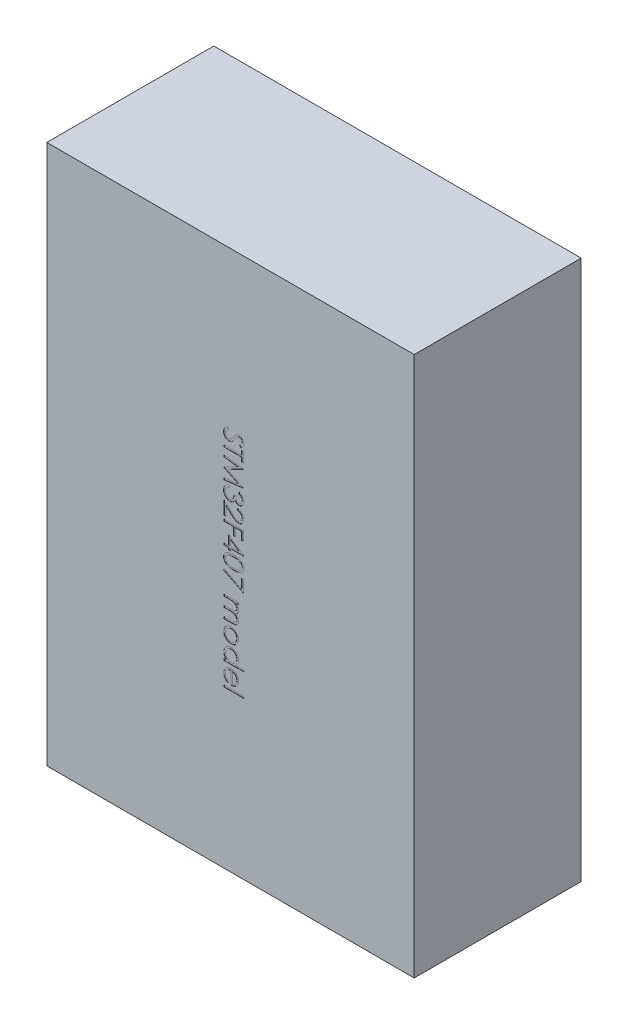
from build123d import *

# Parameters (mm, degrees)
SKETCH_1_W          = 66
SKETCH_1_H          = 97
EXTRUDE_1_DEPTH     = 30
SKETCH_2_W          = 3.58974359
SKETCH_2_H          = 0.314102564
CUT_EXTRUDE_1_DEPTH = 0.04


with BuildPart() as part:
    # 스케치1 → 보스-돌출1 (new body)
    with BuildSketch(Plane.XY):
        Rectangle(SKETCH_1_W, SKETCH_1_H)
    extrude(amount=EXTRUDE_1_DEPTH)

    # 스케치2 → 컷-돌출1 (cut)
    # profile 1 of 14: a face of its own
    with BuildSketch(Plane.XY.offset(30)):
        with BuildLine():
            Line((-0.48025151, 20.483974359), (-0.302867695, 20.188100962))
            add(Edge.make_bspline(
                [(-0.302867695, 20.188100962), (-0.34893208, 20.160582724), (-0.437189664, 20.107858844), (-0.556447705, 20.019907485), (-0.657809861, 19.928774573), (-0.740686469, 19.83378524), (-0.805935356, 19.735519292), (-0.852137587, 19.633335238), (-0.880953563, 19.527577427), (-0.884453649, 19.455603606), (-0.886201029, 19.419671474)],
                knots=[0, 0, 0, 0, 1.272034388, 2.437168799, 3.508375237, 4.49857839, 5.41946034, 6.295179144, 7.148887113, 8, 8, 8, 8], degree=3))
            add(Edge.make_bspline(
                [(-0.886201029, 19.419671474), (-0.885346357, 19.388984611), (-0.883651969, 19.328147831), (-0.867371151, 19.238585635), (-0.842359082, 19.151603657), (-0.806537929, 19.068995675), (-0.763200243, 18.991897693), (-0.710851254, 18.924299317), (-0.652255027, 18.865823682), (-0.586836081, 18.818121937), (-0.516723168, 18.781090763), (-0.444111807, 18.754293981), (-0.369321393, 18.73723944), (-0.318615749, 18.73506874), (-0.29305199, 18.733974359)],
                knots=[0, 0, 0, 0, 1.095270387, 2.171376115, 3.241375676, 4.322296363, 5.380636668, 6.392615365, 7.366724986, 8.328592944, 9.273498763, 10.190095884, 11.087518669, 12, 12, 12, 12], degree=3))
            add(Edge.make_bspline(
                [(-0.29305199, 18.733974359), (-0.263911141, 18.73544867), (-0.204672051, 18.738445728), (-0.117272398, 18.763777208), (-0.030779828, 18.803626455), (0.022721437, 18.840389099), (0.050497689, 18.85947516)],
                knots=[0, 0, 0, 0, 0.938893495, 1.908633276, 2.914225137, 4, 4, 4, 4], degree=3))
            add(Edge.make_bspline(
                [(0.050497689, 18.85947516), (0.070585493, 18.875101411), (0.112881115, 18.908003067), (0.174786586, 18.965349754), (0.240202428, 19.030891476), (0.308863004, 19.104955892), (0.3795144, 19.18901525), (0.453629353, 19.281343492), (0.530985117, 19.382418564), (0.582139729, 19.453651707), (0.608590638, 19.490484776)],
                knots=[0, 0, 0, 0, 0.72226686, 1.520759855, 2.393439377, 3.351307446, 4.386958158, 5.510256019, 6.712608938, 8, 8, 8, 8], degree=3))
            add(Edge.make_bspline(
                [(0.608590638, 19.490484776), (0.634825229, 19.52730386), (0.684983769, 19.597699145), (0.759330441, 19.696221229), (0.827737594, 19.784203539), (0.889252341, 19.862094389), (0.946557644, 19.927878643), (0.996582259, 19.98396119), (1.041997444, 20.028272933), (1.071435414, 20.052931372), (1.084652337, 20.064002404)],
                knots=[0, 0, 0, 0, 1.452255772, 2.776602448, 3.96446981, 5.032613149, 5.964194703, 6.766668629, 7.446264616, 8, 8, 8, 8], degree=3))
            add(Edge.make_bspline(
                [(1.084652337, 20.064002404), (1.105253374, 20.079474949), (1.145768077, 20.109903786), (1.209092935, 20.150069791), (1.2739162, 20.184208954), (1.340412065, 20.210971286), (1.407646994, 20.233507505), (1.47649824, 20.248665436), (1.546656858, 20.258156833), (1.593870359, 20.259128819), (1.617504901, 20.259615385)],
                knots=[0, 0, 0, 0, 1.068054152, 2.10047183, 3.106115577, 4.101338837, 5.06977816, 6.043150881, 7.020423561, 8, 8, 8, 8], degree=3))
            add(Edge.make_bspline(
                [(1.617504901, 20.259615385), (1.654537776, 20.258315869), (1.727811974, 20.255744614), (1.834797821, 20.233821493), (1.937252449, 20.199622872), (2.032919093, 20.150161654), (2.121574036, 20.089009275), (2.201862776, 20.016736768), (2.269933705, 19.930929074), (2.328718871, 19.83625649), (2.375132217, 19.733298793), (2.410329813, 19.62560481), (2.430007424, 19.512702299), (2.432862905, 19.436102663), (2.434311792, 19.397235577)],
                knots=[0, 0, 0, 0, 1.005541892, 1.989591032, 2.955705311, 3.932863626, 4.905387107, 5.876519979, 6.856563935, 7.871847665, 8.897921447, 9.918317993, 10.943742853, 12, 12, 12, 12], degree=3))
            add(Edge.make_bspline(
                [(2.434311792, 19.397235577), (2.432915888, 19.355985329), (2.430147645, 19.274181154), (2.405216629, 19.153625107), (2.364945144, 19.037331335), (2.318562162, 18.943720548), (2.272444271, 18.870583422), (2.230421451, 18.814811656), (2.182047232, 18.758293918), (2.127187723, 18.700575948), (2.06534105, 18.642635263), (1.996930338, 18.583611818), (1.922373789, 18.523367547), (1.869149287, 18.484611688), (1.841863875, 18.46474359)],
                knots=[0, 0, 0, 0, 1.286821612, 2.551921131, 3.825787379, 5.12137259, 5.803616487, 6.523126609, 7.299589446, 8.125436757, 9.008162487, 9.944516264, 10.946261234, 12, 12, 12, 12], degree=3))
            Line((1.841863875, 18.46474359), (1.626619484, 18.748697917))
            add(Edge.make_bspline(
                [(1.626619484, 18.748697917), (1.648708175, 18.765843849), (1.69124583, 18.798862906), (1.750817137, 18.848992395), (1.805233644, 18.896241034), (1.852498681, 18.942791463), (1.895201113, 18.986184999), (1.931759888, 19.028302354), (1.962538672, 19.06853569), (1.995368923, 19.119256839), (2.028119528, 19.183142401), (2.055242621, 19.263258153), (2.072128635, 19.346753238), (2.074256076, 19.403465428), (2.075337433, 19.432291667)],
                knots=[0, 0, 0, 0, 1.181667846, 2.275615987, 3.290305621, 4.226321945, 5.078535498, 5.862783384, 6.581873284, 7.217493746, 8.414623899, 9.604724551, 10.782505457, 12, 12, 12, 12], degree=3))
            add(Edge.make_bspline(
                [(2.075337433, 19.432291667), (2.074125733, 19.468448189), (2.071789084, 19.538172636), (2.046269098, 19.637162873), (2.006087238, 19.726256798), (1.94977226, 19.802809363), (1.883051267, 19.86654634), (1.806272412, 19.912651799), (1.72149001, 19.940401963), (1.662348353, 19.943788243), (1.632228458, 19.945512821)],
                knots=[0, 0, 0, 0, 1.14458467, 2.207223713, 3.21896685, 4.227309161, 5.202851033, 6.127160689, 7.046193047, 8, 8, 8, 8], degree=3))
            add(Edge.make_bspline(
                [(1.632228458, 19.945512821), (1.613481761, 19.945101392), (1.575957711, 19.944277863), (1.520373073, 19.93356699), (1.465281841, 19.918379293), (1.410439046, 19.896151164), (1.35455447, 19.866210872), (1.297778994, 19.825501076), (1.238679174, 19.774571444), (1.200279024, 19.735481868), (1.180004901, 19.71484375)],
                knots=[0, 0, 0, 0, 0.858526328, 1.718456515, 2.587092892, 3.476767204, 4.426280253, 5.487868114, 6.673670035, 8, 8, 8, 8], degree=3))
            add(Edge.make_bspline(
                [(1.180004901, 19.71484375), (1.173167875, 19.707182378), (1.156924667, 19.68898071), (1.130332386, 19.655704785), (1.097529614, 19.611761986), (1.056942297, 19.558299785), (1.009860835, 19.494332424), (0.956887223, 19.419852867), (0.896301764, 19.335691335), (0.853944223, 19.275969419), (0.831547369, 19.244391026)],
                knots=[0, 0, 0, 0, 0.420754252, 0.999615792, 1.744751191, 2.668019286, 3.750313428, 4.999500688, 6.413464383, 8, 8, 8, 8], degree=3))
            add(Edge.make_bspline(
                [(0.831547369, 19.244391026), (0.803906009, 19.206405112), (0.750382347, 19.132850656), (0.669966667, 19.028193076), (0.591318899, 18.933299268), (0.514941292, 18.847836064), (0.441413199, 18.770959156), (0.369850018, 18.703521435), (0.300764446, 18.644835755), (0.21219187, 18.581656536), (0.103410786, 18.517098717), (-0.029867453, 18.46165721), (-0.163663773, 18.426698862), (-0.25359061, 18.422127347), (-0.297959843, 18.419871795)],
                knots=[0, 0, 0, 0, 1.163667725, 2.253281268, 3.268753668, 4.215851969, 5.092017293, 5.902905408, 6.650798638, 7.335211899, 8.59617414, 9.77448103, 10.901945474, 12, 12, 12, 12], degree=3))
            add(Edge.make_bspline(
                [(-0.297959843, 18.419871795), (-0.329337961, 18.420529298), (-0.391484854, 18.421831536), (-0.482743528, 18.436787141), (-0.57136102, 18.458726549), (-0.656322235, 18.491689845), (-0.738764024, 18.532237814), (-0.817926984, 18.582320374), (-0.892722869, 18.642694869), (-0.964708176, 18.709798674), (-1.029731603, 18.784373305), (-1.087887777, 18.863005117), (-1.136564128, 18.946204596), (-1.175748717, 19.033569047), (-1.206881075, 19.124615188), (-1.229258364, 19.219438834), (-1.243023728, 19.318304042), (-1.244450161, 19.385505116), (-1.245175388, 19.419671474)],
                knots=[0, 0, 0, 0, 0.983610584, 1.948120116, 2.894308362, 3.843560551, 4.801159957, 5.773581695, 6.77566113, 7.813174769, 8.857584665, 9.875476876, 10.877851407, 11.875574773, 12.875048225, 13.892438445, 14.928473903, 16, 16, 16, 16], degree=3))
            add(Edge.make_bspline(
                [(-1.245175388, 19.419671474), (-1.244658349, 19.446105651), (-1.243630783, 19.498641092), (-1.234761651, 19.576138789), (-1.221754962, 19.652213394), (-1.201924472, 19.725909697), (-1.177298153, 19.798145352), (-1.147146788, 19.868276473), (-1.111253121, 19.936473445), (-1.0695577, 20.002815905), (-1.021505197, 20.067928988), (-0.965973529, 20.13147888), (-0.903346264, 20.194192596), (-0.832981147, 20.254920498), (-0.755629955, 20.314781958), (-0.670644561, 20.372663746), (-0.578466131, 20.429744504), (-0.513601198, 20.465560107), (-0.48025151, 20.483974359)],
                knots=[0, 0, 0, 0, 0.915384692, 1.819241058, 2.699029451, 3.586605375, 4.459625921, 5.340865773, 6.228072412, 7.126546901, 8.052715223, 9.028303326, 10.047266019, 11.120332924, 12.245748783, 13.433636234, 14.680528497, 16, 16, 16, 16], degree=3))
        make_face()
    # profile 2 of 14: a face of its own
    with BuildSketch(Plane.XY.offset(30)):
        Polygon((1.985593843, 18.105769231), (2.344568202, 18.105769231), (2.344568202, 16.266025641), (1.985593843, 16.266025641), (1.985593843, 17.028846154), (-1.155431798, 17.028846154), (-1.155431798, 17.342948718), (1.985593843, 17.342948718), align=None)
    # profile 3 of 14: a face of its own
    with BuildSketch(Plane.XY.offset(30)):
        Polygon((-1.155431798, 15.817307692), (2.344568202, 15.355268429), (2.344568202, 15.310396635), (-0.52722667, 13.865384615), (2.344568202, 12.423878205), (2.344568202, 12.378305288), (-1.155431798, 11.913461538), (-1.155431798, 12.228966346), (1.362997689, 12.564102564), (-1.155431798, 13.827524038), (-1.155431798, 13.89833734), (1.368606664, 15.166666667), (-1.155431798, 15.501101763), align=None)
    # profile 4 of 14: a face of its own
    with BuildSketch(Plane.XY.offset(30)):
        with BuildLine():
            Line((1.536875894, 11.060897436), (1.536875894, 11.375))
            add(Edge.make_bspline(
                [(1.536875894, 11.375), (1.572108378, 11.366490449), (1.640985003, 11.349854974), (1.739392264, 11.3151574), (1.832515785, 11.277358145), (1.918611859, 11.231969041), (1.999410761, 11.182460286), (2.073079886, 11.125737565), (2.141492851, 11.064417842), (2.202206089, 10.996592893), (2.257183818, 10.925464231), (2.304058875, 10.850029612), (2.344383028, 10.771806718), (2.37760326, 10.690253585), (2.402628784, 10.605127413), (2.420785589, 10.51719779), (2.432576704, 10.42623429), (2.433727467, 10.364486699), (2.434311792, 10.333133013)],
                knots=[0, 0, 0, 0, 1.162005537, 2.271625781, 3.343758855, 4.383309926, 5.390229558, 6.379919256, 7.361854164, 8.333198761, 9.295911338, 10.242430842, 11.177959212, 12.116337295, 13.062827104, 14.020064771, 14.994644689, 16, 16, 16, 16], degree=3))
            add(Edge.make_bspline(
                [(2.434311792, 10.333133013), (2.432932562, 10.287450271), (2.430204186, 10.19708126), (2.40528975, 10.064318213), (2.365864617, 9.936291394), (2.31139089, 9.814402146), (2.244203577, 9.701183713), (2.16423884, 9.600447527), (2.073039539, 9.513559016), (1.972306974, 9.440664638), (1.864651465, 9.383589639), (1.753851308, 9.341503266), (1.640169336, 9.315881585), (1.563412057, 9.312561028), (1.524956824, 9.310897436)],
                knots=[0, 0, 0, 0, 1.083050992, 2.142477498, 3.193116406, 4.255571735, 5.30263384, 6.308962982, 7.297363603, 8.282367274, 9.249857812, 10.179914175, 11.08814088, 12, 12, 12, 12], degree=3))
            add(Edge.make_bspline(
                [(1.524956824, 9.310897436), (1.487950029, 9.312061027), (1.415533475, 9.314337994), (1.309811978, 9.3336717), (1.210170377, 9.366207962), (1.116189215, 9.411277725), (1.028464375, 9.469619275), (0.946798484, 9.540291972), (0.870829326, 9.623794634), (0.827309853, 9.687073572), (0.80490474, 9.719651442)],
                knots=[0, 0, 0, 0, 1.024540389, 2.004866551, 2.965041327, 3.920577974, 4.882998113, 5.874504559, 6.905732034, 8, 8, 8, 8], degree=3))
            add(Edge.make_bspline(
                [(0.80490474, 9.719651442), (0.786926569, 9.682419688), (0.751306611, 9.608652813), (0.681450854, 9.508102284), (0.600794506, 9.416824409), (0.537851854, 9.36592069), (0.506226856, 9.340344551)],
                knots=[0, 0, 0, 0, 1.015518401, 2.012035669, 3.001164323, 4, 4, 4, 4], degree=3))
            add(Edge.make_bspline(
                [(0.506226856, 9.340344551), (0.483171562, 9.323496354), (0.437438519, 9.290075859), (0.363866194, 9.248940479), (0.289721962, 9.211195995), (0.212090569, 9.183417147), (0.133465672, 9.159445102), (0.052163597, 9.143672295), (-0.031043217, 9.133546784), (-0.087359922, 9.132124955), (-0.115668176, 9.131410256)],
                knots=[0, 0, 0, 0, 1.02516404, 2.033540309, 3.025129118, 4.011046665, 4.991655828, 5.976607087, 6.982917762, 8, 8, 8, 8], degree=3))
            add(Edge.make_bspline(
                [(-0.115668176, 9.131410256), (-0.164675949, 9.133208721), (-0.262460862, 9.136797188), (-0.406964816, 9.16874199), (-0.547975555, 9.218550734), (-0.68340376, 9.288046602), (-0.809850337, 9.374031248), (-0.922472366, 9.476894254), (-1.019931281, 9.594135038), (-1.101097929, 9.724986281), (-1.166027745, 9.866690966), (-1.211081952, 10.018269944), (-1.240428833, 10.177519076), (-1.24357558, 10.286726501), (-1.245175388, 10.342247596)],
                knots=[0, 0, 0, 0, 0.95570045, 1.906903359, 2.87519758, 3.868912786, 4.869932978, 5.851730567, 6.836639976, 7.83677598, 8.849487602, 9.869908895, 10.917060885, 12, 12, 12, 12], degree=3))
            add(Edge.make_bspline(
                [(-1.245175388, 10.342247596), (-1.244307174, 10.379666896), (-1.24259882, 10.453295602), (-1.230920219, 10.5615391), (-1.209590214, 10.664860799), (-1.180886908, 10.763400397), (-1.144495166, 10.857245434), (-1.099176468, 10.946109539), (-1.045864966, 11.030539432), (-0.983931379, 11.109738383), (-0.914650039, 11.183696951), (-0.836791029, 11.250449675), (-0.751793625, 11.311109468), (-0.658670569, 11.364052107), (-0.558625311, 11.41168906), (-0.450376813, 11.450870016), (-0.334892791, 11.485355585), (-0.254415051, 11.501389049), (-0.213124106, 11.509615385)],
                knots=[0, 0, 0, 0, 1.048658725, 2.063410685, 3.046034179, 4.001477787, 4.936774919, 5.862367409, 6.792675028, 7.730719943, 8.675894397, 9.627829632, 10.600096036, 11.597688215, 12.626045268, 13.701542398, 14.82072376, 16, 16, 16, 16], degree=3))
            Line((-0.213124106, 11.509615385), (-0.213124106, 11.195512821))
            add(Edge.make_bspline(
                [(-0.213124106, 11.195512821), (-0.240073119, 11.187329529), (-0.292491291, 11.171412316), (-0.367931596, 11.144318018), (-0.437089649, 11.113449746), (-0.500472771, 11.080335188), (-0.558705174, 11.045556742), (-0.610247043, 11.006641817), (-0.657362245, 10.966472671), (-0.683906857, 10.936193318), (-0.696898144, 10.921374199)],
                knots=[0, 0, 0, 0, 1.198163088, 2.33053128, 3.407730985, 4.417276592, 5.372219308, 6.28897303, 7.162600585, 8, 8, 8, 8], degree=3))
            add(Edge.make_bspline(
                [(-0.696898144, 10.921374199), (-0.712006478, 10.901777622), (-0.74217651, 10.862644959), (-0.780678138, 10.798876728), (-0.814039164, 10.731811842), (-0.839522859, 10.659997168), (-0.86110052, 10.584982397), (-0.875221039, 10.505555032), (-0.884909211, 10.422415815), (-0.885764142, 10.365648052), (-0.886201029, 10.336638622)],
                knots=[0, 0, 0, 0, 0.946170439, 1.889420265, 2.845303464, 3.807233317, 4.801018734, 5.828864929, 6.890507805, 8, 8, 8, 8], degree=3))
            add(Edge.make_bspline(
                [(-0.886201029, 10.336638622), (-0.885586125, 10.303884676), (-0.884383734, 10.239837162), (-0.873294033, 10.146388497), (-0.857213621, 10.057458917), (-0.83206073, 9.973955948), (-0.801885683, 9.89474332), (-0.762381007, 9.821589287), (-0.717766863, 9.752343212), (-0.665872032, 9.689033684), (-0.609779337, 9.631957048), (-0.550269987, 9.582636529), (-0.489189158, 9.539919319), (-0.425111959, 9.50558181), (-0.358666935, 9.47841923), (-0.289605381, 9.459939241), (-0.21850884, 9.44708687), (-0.170179773, 9.446040374), (-0.145816413, 9.445512821)],
                knots=[0, 0, 0, 0, 1.216990249, 2.379719373, 3.493992396, 4.571561497, 5.616923107, 6.638958652, 7.655775068, 8.674704564, 9.676001865, 10.625896028, 11.54399481, 12.441854662, 13.322657739, 14.20572845, 15.095482574, 16, 16, 16, 16], degree=3))
            add(Edge.make_bspline(
                [(-0.145816413, 9.445512821), (-0.113205038, 9.447043095), (-0.048144556, 9.450096029), (0.047572466, 9.473405016), (0.139798032, 9.511742292), (0.226945386, 9.565421023), (0.307753545, 9.630732968), (0.379572189, 9.707045912), (0.439428888, 9.79454705), (0.480631994, 9.875599726), (0.508092132, 9.94756673), (0.527346667, 10.009032269), (0.5427384, 10.077905685), (0.557626842, 10.153360168), (0.570108367, 10.235713945), (0.580562133, 10.325041214), (0.588913648, 10.421377911), (0.592645249, 10.488068943), (0.594568202, 10.522435897)],
                knots=[0, 0, 0, 0, 1.070481957, 2.135637345, 3.216366529, 4.339485895, 5.485746587, 6.620975969, 7.768829582, 8.956804399, 9.598399438, 10.297751078, 11.070570279, 11.915248466, 12.824061284, 13.805856426, 14.869322739, 16, 16, 16, 16], degree=3))
            Line((0.594568202, 10.522435897), (0.953542561, 10.522435897))
            add(Edge.make_bspline(
                [(0.953542561, 10.522435897), (0.954280569, 10.479135929), (0.955726144, 10.394321926), (0.973089054, 10.270410774), (0.997377481, 10.151780492), (1.033721882, 10.041138949), (1.077345535, 9.94062194), (1.126534391, 9.852936591), (1.182263158, 9.78016101), (1.243800448, 9.722113374), (1.310570623, 9.67950847), (1.379434121, 9.64752927), (1.451993165, 9.628781767), (1.501483149, 9.626265028), (1.526359067, 9.625)],
                knots=[0, 0, 0, 0, 1.321708579, 2.588902423, 3.815526512, 5.016621128, 6.138757764, 7.158873101, 8.079948563, 8.928590313, 9.728601868, 10.489025425, 11.240515403, 12, 12, 12, 12], degree=3))
            add(Edge.make_bspline(
                [(1.526359067, 9.625), (1.544636857, 9.625414363), (1.580999651, 9.626238718), (1.634124075, 9.636636703), (1.685627428, 9.652258102), (1.735276018, 9.673747955), (1.782781661, 9.702459319), (1.828202639, 9.73692252), (1.872300159, 9.777154193), (1.912964542, 9.82420579), (1.951321468, 9.875144163), (1.984479604, 9.930448608), (2.012584418, 9.988899319), (2.035804985, 10.050550046), (2.053261227, 10.115647759), (2.065797922, 10.183873705), (2.073635339, 10.255361559), (2.074763788, 10.304133268), (2.075337433, 10.328926282)],
                knots=[0, 0, 0, 0, 0.884317272, 1.759307272, 2.611736065, 3.488921043, 4.37244062, 5.294096728, 6.247679003, 7.258495569, 8.302441962, 9.333537773, 10.376747089, 11.440883505, 12.520330301, 13.637364711, 14.798958396, 16, 16, 16, 16], degree=3))
            add(Edge.make_bspline(
                [(2.075337433, 10.328926282), (2.07394877, 10.368779267), (2.071236388, 10.446621416), (2.047395772, 10.558817984), (2.009622773, 10.663012212), (1.964011989, 10.742387195), (1.919143197, 10.80109994), (1.880542575, 10.843859911), (1.836777376, 10.885084904), (1.78664717, 10.923157211), (1.731875731, 10.960358207), (1.672161399, 10.996332678), (1.606652826, 11.029925122), (1.56058531, 11.050373392), (1.536875894, 11.060897436)],
                knots=[0, 0, 0, 0, 1.4727372, 2.876598283, 4.222346151, 5.558423782, 6.24313385, 6.953189256, 7.68715613, 8.463578749, 9.278833271, 10.135787152, 11.040551781, 12, 12, 12, 12], degree=3))
        make_face()
    # profile 5 of 14: a face of its own
    with BuildSketch(Plane.XY.offset(30)):
        with BuildLine():
            Line((1.267645125, 8.368589744), (1.267645125, 8.682692308))
            add(Edge.make_bspline(
                [(1.267645125, 8.682692308), (1.309316218, 8.680645503), (1.391157136, 8.676625633), (1.510478136, 8.657792414), (1.624543454, 8.630869381), (1.73237519, 8.592713163), (1.835261485, 8.545593569), (1.931836127, 8.487905549), (2.023057608, 8.420878919), (2.107198803, 8.344636643), (2.184114376, 8.261906746), (2.251237791, 8.17318491), (2.307301642, 8.079383026), (2.354424602, 7.981314694), (2.389753157, 7.877845722), (2.41597788, 7.76996516), (2.431753384, 7.657185398), (2.433449286, 7.580345462), (2.434311792, 7.541266026)],
                knots=[0, 0, 0, 0, 1.100776268, 2.161895295, 3.184016182, 4.190939212, 5.176500551, 6.166955529, 7.155448256, 8.160289653, 9.16017456, 10.133824356, 11.091467644, 12.04088621, 13.000931625, 13.972173743, 14.968683325, 16, 16, 16, 16], degree=3))
            add(Edge.make_bspline(
                [(2.434311792, 7.541266026), (2.433413335, 7.502887952), (2.431647901, 7.427476407), (2.416486871, 7.317414392), (2.39274128, 7.212637098), (2.359425863, 7.113349331), (2.314641436, 7.020343267), (2.260843897, 6.932920222), (2.198624066, 6.850039412), (2.125370252, 6.775432628), (2.047167868, 6.706924549), (1.963679964, 6.647822294), (1.877450679, 6.59720913), (1.787822477, 6.55502145), (1.693951449, 6.523965311), (1.597204246, 6.500387103), (1.496579435, 6.48705969), (1.428472879, 6.485014266), (1.393847048, 6.483974359)],
                knots=[0, 0, 0, 0, 1.111607364, 2.184268762, 3.212621178, 4.221274766, 5.211760367, 6.196651075, 7.1921475, 8.207485113, 9.220403448, 10.201281604, 11.166441695, 12.114753415, 13.065576456, 14.026450734, 14.996634279, 16, 16, 16, 16], degree=3))
            add(Edge.make_bspline(
                [(1.393847048, 6.483974359), (1.345099214, 6.485667622), (1.248459, 6.489024433), (1.106444137, 6.51773881), (0.968850718, 6.562585321), (0.858113416, 6.616582678), (0.768879922, 6.671055122), (0.695411217, 6.720142629), (0.616305749, 6.77760744), (0.531828412, 6.844285938), (0.441317506, 6.91879881), (0.344827711, 7.001820974), (0.243355941, 7.093944456), (0.17405034, 7.158602957), (0.138137914, 7.192107372)],
                knots=[0, 0, 0, 0, 1.184426356, 2.348067706, 3.509069118, 4.696110526, 5.333549288, 6.050745305, 6.844228056, 7.710549037, 8.667450064, 9.695053472, 10.805634456, 12, 12, 12, 12], degree=3))
            Line((0.138137914, 7.192107372), (-0.796457439, 8.067808494))
            Line((-0.796457439, 8.067808494), (-0.796457439, 6.439102564))
            Line((-0.796457439, 6.439102564), (-1.155431798, 6.439102564))
            Line((-1.155431798, 6.439102564), (-1.155431798, 8.817307692))
            Line((-1.155431798, 8.817307692), (0.29308583, 7.459935897))
            add(Edge.make_bspline(
                [(0.29308583, 7.459935897), (0.327582255, 7.426885671), (0.393842828, 7.36340295), (0.490610543, 7.273651156), (0.580277879, 7.192909946), (0.663242173, 7.121125762), (0.739033094, 7.058239538), (0.808244599, 7.004452483), (0.870282734, 6.959526867), (0.943162541, 6.911915077), (1.032250071, 6.866514075), (1.140572066, 6.82661124), (1.252327659, 6.802454607), (1.327825909, 6.799541993), (1.365802176, 6.798076923)],
                knots=[0, 0, 0, 0, 1.329530082, 2.553755191, 3.672934919, 4.687409497, 5.60679272, 6.413407421, 7.126401618, 7.737995624, 8.834647426, 9.90044882, 10.943907757, 12, 12, 12, 12], degree=3))
            add(Edge.make_bspline(
                [(1.365802176, 6.798076923), (1.389686214, 6.798706135), (1.436757065, 6.799946191), (1.505724959, 6.811097587), (1.57251049, 6.827481201), (1.636287902, 6.852733411), (1.698311574, 6.883073012), (1.756695792, 6.921834089), (1.813430736, 6.966127822), (1.866571009, 7.017506379), (1.915255752, 7.073910489), (1.958378913, 7.133506674), (1.994418265, 7.196556273), (2.023961698, 7.262796531), (2.047137096, 7.332041963), (2.063195671, 7.404426718), (2.073278156, 7.479750732), (2.074642328, 7.531184228), (2.075337433, 7.557391827)],
                knots=[0, 0, 0, 0, 0.991504627, 1.954065223, 2.895985987, 3.842598665, 4.797835564, 5.759220273, 6.74786863, 7.784730864, 8.824135544, 9.839918996, 10.835834653, 11.835434876, 12.84861661, 13.863796685, 14.911511676, 16, 16, 16, 16], degree=3))
            add(Edge.make_bspline(
                [(2.075337433, 7.557391827), (2.074622617, 7.584762781), (2.073218836, 7.638514816), (2.063393104, 7.717432125), (2.046458431, 7.792724176), (2.023241353, 7.864543382), (1.994010868, 7.932958939), (1.956900566, 7.997352234), (1.913359371, 8.058311156), (1.863724785, 8.115723747), (1.808202619, 8.16847691), (1.747071851, 8.215800783), (1.679934836, 8.256163045), (1.608307994, 8.291942373), (1.530286859, 8.319318854), (1.44776206, 8.342720007), (1.359561118, 8.359719214), (1.298792667, 8.36558379), (1.267645125, 8.368589744)],
                knots=[0, 0, 0, 0, 1.031212865, 2.025131798, 2.990757446, 3.934781266, 4.865570067, 5.788494791, 6.729227313, 7.684356718, 8.643577152, 9.610526866, 10.590658432, 11.59095419, 12.621640561, 13.700587263, 14.82141059, 16, 16, 16, 16], degree=3))
        make_face()
    # profile 6 of 14: a face of its own
    with BuildSketch(Plane.XY.offset(30)):
        Polygon((2.344568202, 5.810897436), (2.344568202, 4.105769231), (1.985593843, 4.105769231), (1.985593843, 5.496794872), (0.908670766, 5.496794872), (0.908670766, 4.105769231), (0.549696407, 4.105769231), (0.549696407, 5.496794872), (-1.155431798, 5.496794872), (-1.155431798, 5.810897436), align=None)
    # profile 7 of 14: a face of its own
    with BuildSketch(Plane.XY.offset(30)):
        Polygon((2.434311792, 1.881109776), (2.434311792, 1.817307692), (0.011234869, 1.817307692), (0.011234869, 1.413461538), (-0.34773949, 1.413461538), (-0.34773949, 1.817307692), (-1.155431798, 1.817307692), (-1.155431798, 2.131410256), (-0.34773949, 2.131410256), (-0.34773949, 3.791666667), align=None)
        Polygon((0.011234869, 2.131410256), (1.53126692, 2.131410256), (0.011234869, 3.174679487), align=None, mode=Mode.SUBTRACT)
    # profile 8 of 14: a face of its own
    with BuildSketch(Plane.XY.offset(30)):
        with BuildLine():
            add(Edge.make_bspline(
                [(0.593165958, 1.099358974), (0.649263346, 1.099030956), (0.75823333, 1.098393776), (0.917017972, 1.091305355), (1.065978262, 1.079530014), (1.205121326, 1.063392638), (1.334483098, 1.043754666), (1.453717829, 1.017539151), (1.563377524, 0.987726445), (1.663819275, 0.953173674), (1.756398002, 0.914187005), (1.842819592, 0.871748796), (1.922974328, 0.824198001), (1.998066347, 0.77417104), (2.067257586, 0.719839794), (2.130417014, 0.661777324), (2.187582769, 0.599407674), (2.239435218, 0.533964374), (2.284605312, 0.46503384), (2.325306568, 0.39474097), (2.358712579, 0.32184539), (2.386161598, 0.247011931), (2.408155802, 0.170458217), (2.423386746, 0.091867933), (2.432932453, 0.011222092), (2.43384765, -0.043208731), (2.434311792, -0.070813301)],
                knots=[0, 0, 0, 0, 1.646377244, 3.198111528, 4.663803227, 6.031090796, 7.308794487, 8.502186765, 9.612154809, 10.642545331, 11.617106989, 12.558866172, 13.465886467, 14.35053239, 15.20542558, 16.045215227, 16.865619885, 17.686225247, 18.492864914, 19.282407821, 20.068097601, 20.842842034, 21.620163247, 22.403093475, 23.190129512, 24, 24, 24, 24], degree=3))
            add(Edge.make_bspline(
                [(2.434311792, -0.070813301), (2.433823977, -0.09864878), (2.432853866, -0.154004789), (2.423529923, -0.235845164), (2.4080588, -0.315794846), (2.386137825, -0.393512984), (2.358942149, -0.469637971), (2.324855032, -0.543574378), (2.285176164, -0.61578146), (2.238552287, -0.685111748), (2.186570011, -0.752326363), (2.127807342, -0.815774326), (2.062857623, -0.875461412), (1.992415759, -0.932136717), (1.915130674, -0.984192314), (1.832346564, -1.033765747), (1.742615699, -1.078137783), (1.647435232, -1.120872458), (1.544171573, -1.157759444), (1.433406812, -1.19102569), (1.313832625, -1.217904658), (1.18607638, -1.240293931), (1.049668897, -1.257638827), (0.904902581, -1.270271469), (0.751682191, -1.276944554), (0.646924342, -1.278201255), (0.593165958, -1.278846154)],
                knots=[0, 0, 0, 0, 0.810914788, 1.612654377, 2.396697861, 3.181598691, 3.963628158, 4.749916497, 5.551656086, 6.361998678, 7.18212741, 8.025565596, 8.878627764, 9.750805457, 10.657531673, 11.591944965, 12.560506719, 13.57287815, 14.630710178, 15.753379473, 16.941251878, 18.199788006, 19.531962791, 20.947069417, 22.433333509, 24, 24, 24, 24], degree=3))
            add(Edge.make_bspline(
                [(0.593165958, -1.278846154), (0.539642251, -1.278193764), (0.435353489, -1.276922609), (0.282819748, -1.270355028), (0.138831419, -1.257357308), (0.002987692, -1.241281179), (-0.123904886, -1.218380955), (-0.243052908, -1.192347436), (-0.353428147, -1.159990566), (-0.456147202, -1.123606351), (-0.550861347, -1.081798976), (-0.639816531, -1.037034773), (-0.722533092, -0.987765633), (-0.799817053, -0.935399588), (-0.870869831, -0.879206016), (-0.93586703, -0.81926619), (-0.994765778, -0.755534488), (-1.047458295, -0.688167907), (-1.093539437, -0.617746957), (-1.134728567, -0.545780893), (-1.168150992, -0.470833339), (-1.196370193, -0.394569943), (-1.218341597, -0.31627111), (-1.23338527, -0.236013641), (-1.243965213, -0.154060376), (-1.244770599, -0.09865841), (-1.245175388, -0.070813301)],
                knots=[0, 0, 0, 0, 1.56130642, 3.042141888, 4.451772327, 5.777565838, 7.030558081, 8.211376819, 9.333164717, 10.383253789, 11.387583522, 12.350962576, 13.286244149, 14.193812918, 15.072134482, 15.925989337, 16.770211267, 17.600669898, 18.417446232, 19.22325363, 20.01647746, 20.807971184, 21.593601364, 22.38506573, 23.188331689, 24, 24, 24, 24], degree=3))
            add(Edge.make_bspline(
                [(-1.245175388, -0.070813301), (-1.24470678, -0.043209853), (-1.243782776, 0.01121876), (-1.234301582, 0.091880798), (-1.218840949, 0.170348513), (-1.197845485, 0.246778767), (-1.171161497, 0.321327975), (-1.137220452, 0.393265855), (-1.097854119, 0.463542459), (-1.05306755, 0.531837112), (-1.001743307, 0.596848159), (-0.944980219, 0.658948076), (-0.881354552, 0.716568863), (-0.811884732, 0.770219166), (-0.73716021, 0.821130389), (-0.656444895, 0.868215221), (-0.569213586, 0.910570652), (-0.476123795, 0.950431045), (-0.374943847, 0.985567906), (-0.264699272, 1.016370873), (-0.144780224, 1.042049455), (-0.015542705, 1.062700304), (0.123110013, 1.079724851), (0.271422055, 1.091249597), (0.429265462, 1.098399421), (0.537535492, 1.099033287), (0.593165958, 1.099358974)],
                knots=[0, 0, 0, 0, 0.810940842, 1.599017053, 2.38298203, 3.159479784, 3.926441347, 4.70693857, 5.494146311, 6.292334103, 7.104379492, 7.925868426, 8.762126819, 9.623561095, 10.503686106, 11.41783325, 12.366995289, 13.351843594, 14.392337808, 15.512229747, 16.713911458, 17.994391108, 19.357476964, 20.818259213, 22.365182633, 24, 24, 24, 24], degree=3))
        make_face()
        with BuildLine():
            add(Edge.make_bspline(
                [(0.594568202, 0.78525641), (0.547819503, 0.785136963), (0.457089458, 0.78490514), (0.325246198, 0.778848939), (0.202275868, 0.770598708), (0.088022334, 0.759957408), (-0.017127687, 0.744154469), (-0.113897342, 0.72644765), (-0.201774671, 0.704899663), (-0.281362179, 0.679404307), (-0.354012279, 0.65036636), (-0.421609891, 0.618656482), (-0.484974579, 0.584609966), (-0.543462767, 0.546440211), (-0.597656665, 0.50501299), (-0.647400533, 0.460260276), (-0.692477326, 0.412260776), (-0.745965312, 0.345813734), (-0.80189182, 0.258523265), (-0.849992887, 0.14797643), (-0.880416967, 0.034335044), (-0.884275243, -0.042819769), (-0.886201029, -0.081330128)],
                knots=[0, 0, 0, 0, 1.459116078, 2.831857795, 4.118796693, 5.306371758, 6.412361096, 7.436813035, 8.376339383, 9.234574298, 10.043323891, 10.816788787, 11.564361537, 12.286735248, 12.994408768, 13.691741332, 14.372975427, 15.047457468, 16.352811911, 17.594285292, 18.799233213, 20, 20, 20, 20], degree=3))
            add(Edge.make_bspline(
                [(-0.886201029, -0.081330128), (-0.884603248, -0.1200878), (-0.881410985, -0.197523123), (-0.850612248, -0.310656918), (-0.804142708, -0.420487188), (-0.749195203, -0.506559129), (-0.696866873, -0.572041672), (-0.652252225, -0.618958662), (-0.602296358, -0.662020711), (-0.548397062, -0.702862785), (-0.489524578, -0.740321861), (-0.425962002, -0.774384999), (-0.357532825, -0.805468346), (-0.309763085, -0.823177392), (-0.285339651, -0.832231571)],
                knots=[0, 0, 0, 0, 1.353760809, 2.704726607, 4.075137775, 5.516104923, 6.260822281, 7.007110065, 7.778089737, 8.566572457, 9.372053459, 10.217411131, 11.088608312, 12, 12, 12, 12], degree=3))
            add(Edge.make_bspline(
                [(-0.285339651, -0.832231571), (-0.254109911, -0.842783338), (-0.190700147, -0.864207952), (-0.092336495, -0.891819726), (0.010866269, -0.913565126), (0.118291386, -0.933128491), (0.230731087, -0.946481547), (0.347837471, -0.957229361), (0.469698833, -0.963560047), (0.552493824, -0.964344799), (0.594568202, -0.96474359)],
                knots=[0, 0, 0, 0, 0.884706709, 1.796334032, 2.740027952, 3.714592787, 4.726048262, 5.777819803, 6.87074269, 8, 8, 8, 8], degree=3))
            add(Edge.make_bspline(
                [(0.594568202, -0.96474359), (0.636641675, -0.964303766), (0.718956565, -0.963443269), (0.839383322, -0.957789731), (0.953962664, -0.948704965), (1.062798533, -0.936408934), (1.165697214, -0.919529083), (1.262805954, -0.899258062), (1.354098572, -0.875492616), (1.439810505, -0.848232941), (1.519633682, -0.817511665), (1.593741892, -0.783573866), (1.662528014, -0.747357636), (1.725794605, -0.708014009), (1.783827236, -0.666018675), (1.835461808, -0.620261037), (1.882298782, -0.572556687), (1.935761349, -0.505739494), (1.990273046, -0.418265208), (2.040438805, -0.309419559), (2.069247098, -0.196148915), (2.073308785, -0.119575461), (2.075337433, -0.081330128)],
                knots=[0, 0, 0, 0, 1.313668642, 2.570134578, 3.763346207, 4.902004944, 5.98888779, 7.017888835, 7.998425394, 8.933058446, 9.82474457, 10.667209444, 11.476765193, 12.250262638, 12.991704352, 13.7104269, 14.401925311, 15.076585796, 16.378385137, 17.609787933, 18.806186071, 20, 20, 20, 20], degree=3))
            add(Edge.make_bspline(
                [(2.075337433, -0.081330128), (2.073308603, -0.042617911), (2.069247248, 0.034877049), (2.040514348, 0.14930038), (1.9907401, 0.258921388), (1.935409331, 0.345693876), (1.88324522, 0.412426767), (1.837883111, 0.459549504), (1.78798876, 0.503604357), (1.734024306, 0.545066092), (1.675506618, 0.583199102), (1.612151145, 0.617259552), (1.544547251, 0.648951227), (1.47191368, 0.678051518), (1.392206189, 0.703310597), (1.304772368, 0.725887555), (1.207912326, 0.743583632), (1.102468334, 0.759025977), (0.988074346, 0.77079989), (0.864820513, 0.77882776), (0.732749253, 0.784916098), (0.641551079, 0.785140701), (0.594568202, 0.78525641)],
                knots=[0, 0, 0, 0, 1.207964612, 2.418129846, 3.655795183, 4.951004962, 5.620895151, 6.296795572, 6.989224116, 7.696855977, 8.419187164, 9.166715907, 9.940135271, 10.748837255, 11.607021648, 12.548275234, 13.5654991, 14.678641405, 15.874140913, 17.15372626, 18.533675393, 20, 20, 20, 20], degree=3))
        make_face(mode=Mode.SUBTRACT)
    # profile 9 of 14: a face of its own
    with BuildSketch(Plane.XY.offset(30)):
        Polygon((2.344568202, -1.817307692), (2.344568202, -3.971153846), (-1.245175388, -2.131410256), (-1.095836445, -1.860076122), (1.985593843, -3.439703526), (1.985593843, -1.817307692), align=None)
    # profile 10 of 14: a face of its own
    with BuildSketch(Plane.XY.offset(30)):
        with BuildLine():
            Line((1.40226051, -5.855769231), (1.40226051, -6.169871795))
            Line((1.40226051, -6.169871795), (0.957749292, -6.169871795))
            add(Edge.make_bspline(
                [(0.957749292, -6.169871795), (0.996579358, -6.198217095), (1.070855426, -6.252437385), (1.169823804, -6.340495375), (1.252432764, -6.429978935), (1.296366122, -6.493967619), (1.317424773, -6.524639423)],
                knots=[0, 0, 0, 0, 1.134266299, 2.169680534, 3.122669868, 4, 4, 4, 4], degree=3))
            add(Edge.make_bspline(
                [(1.317424773, -6.524639423), (1.337430138, -6.566504085), (1.377091351, -6.649501985), (1.41732491, -6.78092121), (1.442050011, -6.915395879), (1.445431385, -7.006204093), (1.447132305, -7.051883013)],
                knots=[0, 0, 0, 0, 1.014936303, 2.012140481, 3.000054389, 4, 4, 4, 4], degree=3))
            add(Edge.make_bspline(
                [(1.447132305, -7.051883013), (1.44608424, -7.082774884), (1.444010176, -7.143908237), (1.430590636, -7.234508752), (1.407114908, -7.322516802), (1.375244932, -7.407361516), (1.335415774, -7.486813784), (1.289616846, -7.55979164), (1.237884138, -7.625398942), (1.178214519, -7.683529412), (1.10887529, -7.73579719), (1.028011846, -7.783876418), (0.93380394, -7.828301514), (0.865437436, -7.85292284), (0.829444003, -7.865885417)],
                knots=[0, 0, 0, 0, 1.009798505, 1.998336943, 2.985959917, 3.981996858, 4.955664737, 5.886087062, 6.794002107, 7.679958053, 8.601272429, 9.625787331, 10.750030247, 12, 12, 12, 12], degree=3))
            add(Edge.make_bspline(
                [(0.829444003, -7.865885417), (0.854168422, -7.879596668), (0.902822607, -7.906578485), (0.971680873, -7.951884121), (1.036087648, -7.999351923), (1.096094134, -8.049386395), (1.151403644, -8.10181106), (1.202200343, -8.156872177), (1.248697628, -8.214257998), (1.303035012, -8.294045187), (1.360525567, -8.397703423), (1.411018922, -8.528432567), (1.441573583, -8.664693682), (1.445270213, -8.757325339), (1.447132305, -8.803986378)],
                knots=[0, 0, 0, 0, 0.861170869, 1.694663331, 2.509326413, 3.297991968, 4.073691563, 4.829592376, 5.579160782, 6.321830913, 7.768780219, 9.179854006, 10.579417172, 12, 12, 12, 12], degree=3))
            add(Edge.make_bspline(
                [(1.447132305, -8.803986378), (1.445515084, -8.846867841), (1.442350026, -8.930791027), (1.417496552, -9.052968293), (1.374818905, -9.166910098), (1.316585268, -9.272387174), (1.243406085, -9.367546988), (1.156337248, -9.450263297), (1.055994625, -9.52003366), (0.961602636, -9.5656123), (0.878267303, -9.596527564), (0.807261012, -9.615588799), (0.729109459, -9.632428494), (0.643719197, -9.646409739), (0.550788589, -9.656628291), (0.450469713, -9.664199007), (0.342684601, -9.66932308), (0.268319101, -9.669685152), (0.229984869, -9.669871795)],
                knots=[0, 0, 0, 0, 1.209669288, 2.367440248, 3.500751976, 4.631527125, 5.755587489, 6.87532382, 8.007944318, 9.190864318, 9.82315674, 10.514484317, 11.263564316, 12.079023757, 12.955305781, 13.901327259, 14.918167583, 16, 16, 16, 16], degree=3))
            Line((0.229984869, -9.669871795), (-1.155431798, -9.669871795))
            Line((-1.155431798, -9.669871795), (-1.155431798, -9.355769231))
            Line((-1.155431798, -9.355769231), (0.231387112, -9.355769231))
            add(Edge.make_bspline(
                [(0.231387112, -9.355769231), (0.264107686, -9.355691348), (0.326991653, -9.355541669), (0.417244105, -9.352848037), (0.499512461, -9.347772723), (0.573684552, -9.341838085), (0.639933331, -9.333594271), (0.698125779, -9.322948354), (0.748719499, -9.311670629), (0.804805907, -9.292934817), (0.866673694, -9.262985718), (0.933407137, -9.217373155), (0.991450791, -9.159884537), (1.042139434, -9.093432597), (1.082521101, -9.017588954), (1.112450953, -8.934349729), (1.130144049, -8.843995668), (1.132051653, -8.781395771), (1.13302974, -8.749298878)],
                knots=[0, 0, 0, 0, 1.253542879, 2.409118771, 3.458568974, 4.411070626, 5.259544058, 6.014735414, 6.677123945, 7.243402448, 8.276608576, 9.299873988, 10.325604302, 11.392892819, 12.490509435, 13.603538441, 14.771260462, 16, 16, 16, 16], degree=3))
            add(Edge.make_bspline(
                [(1.13302974, -8.749298878), (1.131582744, -8.709637189), (1.128714615, -8.631022741), (1.100519108, -8.516454668), (1.05695363, -8.406658277), (0.994753648, -8.30458492), (0.919913056, -8.210569076), (0.830971985, -8.129666339), (0.73033974, -8.062835012), (0.637193618, -8.017580821), (0.553524088, -7.988991551), (0.480426737, -7.970114628), (0.397345163, -7.955431239), (0.304837674, -7.941660709), (0.202267493, -7.932672981), (0.090109092, -7.924504609), (-0.031974867, -7.920683746), (-0.116601556, -7.920149287), (-0.160539971, -7.919871795)],
                knots=[0, 0, 0, 0, 1.090512009, 2.161531735, 3.230072964, 4.332825141, 5.440581378, 6.529496625, 7.62916386, 8.757669174, 9.370357692, 10.061947597, 10.834545503, 11.692923569, 12.636967211, 13.669242667, 14.789864225, 16, 16, 16, 16], degree=3))
            Line((-0.160539971, -7.919871795), (-1.155431798, -7.919871795))
            Line((-1.155431798, -7.919871795), (-1.155431798, -7.605769231))
            Line((-1.155431798, -7.605769231), (0.145149132, -7.605769231))
            add(Edge.make_bspline(
                [(0.145149132, -7.605769231), (0.181842866, -7.605693359), (0.252437922, -7.605547389), (0.353666128, -7.602824208), (0.445765175, -7.597891539), (0.528503812, -7.591520593), (0.60210688, -7.584605941), (0.666332935, -7.573663316), (0.721449233, -7.562256717), (0.782483442, -7.544849207), (0.84869079, -7.514698018), (0.919810451, -7.468834821), (0.9824882, -7.411859946), (1.03563861, -7.344167415), (1.07920511, -7.267729053), (1.111080175, -7.183631291), (1.129465088, -7.09240542), (1.131819115, -7.029530657), (1.13302974, -6.997195513)],
                knots=[0, 0, 0, 0, 1.320226356, 2.539982809, 3.643122147, 4.638255983, 5.52602392, 6.301561104, 6.98107216, 7.550523949, 8.58191082, 9.584830316, 10.584890324, 11.614493144, 12.668965657, 13.738783174, 14.837104585, 16, 16, 16, 16], degree=3))
            add(Edge.make_bspline(
                [(1.13302974, -6.997195513), (1.13149928, -6.959179302), (1.128449128, -6.883414343), (1.100994855, -6.772112369), (1.057990778, -6.664626701), (0.998330968, -6.562671943), (0.924431855, -6.468998019), (0.837517086, -6.386988918), (0.738667572, -6.31804954), (0.64650462, -6.272307488), (0.56492788, -6.242831683), (0.495589198, -6.223156099), (0.418499459, -6.206656187), (0.333827341, -6.19267055), (0.241397104, -6.182146556), (0.141469973, -6.175850111), (0.033730344, -6.170315446), (-0.040639674, -6.170023306), (-0.079209843, -6.169871795)],
                knots=[0, 0, 0, 0, 1.098813768, 2.189896819, 3.297771711, 4.440532809, 5.596253211, 6.739894833, 7.8864334, 9.072265856, 9.705655743, 10.395080422, 11.156654178, 11.986235968, 12.878145268, 13.847797945, 14.883813667, 16, 16, 16, 16], degree=3))
            Line((-0.079209843, -6.169871795), (-1.155431798, -6.169871795))
            Line((-1.155431798, -6.169871795), (-1.155431798, -5.855769231))
            Line((-1.155431798, -5.855769231), (1.40226051, -5.855769231))
        make_face()
    # profile 11 of 14: a face of its own
    with BuildSketch(Plane.XY.offset(30)):
        with BuildLine():
            add(Edge.make_bspline(
                [(1.447132305, -11.623197115), (1.446113412, -11.67118958), (1.444115614, -11.765291073), (1.422658182, -11.903082089), (1.390119357, -12.034475816), (1.344316728, -12.160035895), (1.284221889, -12.278723689), (1.211549347, -12.391598885), (1.125807431, -12.498435334), (1.059443775, -12.562455693), (1.025758106, -12.594951923)],
                knots=[0, 0, 0, 0, 1.054042676, 2.066720093, 3.05716247, 4.025731183, 4.997454851, 5.974904663, 6.97207755, 8, 8, 8, 8], degree=3))
            add(Edge.make_bspline(
                [(1.025758106, -12.594951923), (0.99354412, -12.622933877), (0.929739578, -12.678356257), (0.826283965, -12.749421976), (0.719143864, -12.810643536), (0.606896538, -12.859706497), (0.490521866, -12.898391521), (0.369619855, -12.925857217), (0.244457508, -12.942194152), (0.15945367, -12.944397119), (0.116403138, -12.945512821)],
                knots=[0, 0, 0, 0, 1.025258237, 2.030674902, 3.01204498, 3.988269485, 4.97094183, 5.956517959, 6.965070386, 8, 8, 8, 8], degree=3))
            add(Edge.make_bspline(
                [(0.116403138, -12.945512821), (0.07310308, -12.944531483), (-0.012459853, -12.942592315), (-0.138479218, -12.924248698), (-0.260674044, -12.895717614), (-0.378532725, -12.85488577), (-0.492415602, -12.802527683), (-0.601824959, -12.738636909), (-0.706977833, -12.662765627), (-0.806976802, -12.576760331), (-0.899153718, -12.4817133), (-0.979443233, -12.378579603), (-1.048519751, -12.269311224), (-1.103385713, -12.152416542), (-1.147611499, -12.029559516), (-1.178108026, -11.899958698), (-1.196711734, -11.763729703), (-1.199089465, -11.670700247), (-1.200303593, -11.623197115)],
                knots=[0, 0, 0, 0, 0.998669827, 1.973418153, 2.932281609, 3.89081133, 4.846438734, 5.82045571, 6.809776312, 7.834649874, 8.860672198, 9.859676908, 10.845817165, 11.837296335, 12.833502054, 13.853824644, 14.904110009, 16, 16, 16, 16], degree=3))
            add(Edge.make_bspline(
                [(-1.200303593, -11.623197115), (-1.199079419, -11.575463531), (-1.196681814, -11.481974896), (-1.178246411, -11.345232941), (-1.147285657, -11.215086463), (-1.103933218, -11.091648295), (-1.048069099, -10.974754087), (-0.979712003, -10.865082233), (-0.899113061, -10.761899889), (-0.806987818, -10.66682306), (-0.706974995, -10.580825754), (-0.601825696, -10.50495241), (-0.492415411, -10.441062171), (-0.378532776, -10.388703944), (-0.260674031, -10.347872138), (-0.138479222, -10.319341043), (-0.012459852, -10.300997429), (0.073103081, -10.299058261), (0.116403138, -10.298076923)],
                knots=[0, 0, 0, 0, 1.099861214, 2.154133753, 3.1731438, 4.178222029, 5.163564916, 6.153006591, 7.15072618, 8.175428628, 9.198983792, 10.187031731, 11.15979573, 12.114193814, 13.071490482, 14.029120454, 15.002614863, 16, 16, 16, 16], degree=3))
            add(Edge.make_bspline(
                [(0.116403138, -10.298076923), (0.159219684, -10.299200233), (0.243989086, -10.301424195), (0.368916147, -10.317744704), (0.489613536, -10.34510326), (0.605539012, -10.383834657), (0.717294448, -10.433349848), (0.824699279, -10.493711136), (0.927687079, -10.565501768), (0.991409159, -10.62070372), (1.02365474, -10.648637821)],
                knots=[0, 0, 0, 0, 1.031353054, 2.041901799, 3.029428768, 4.008703097, 4.981709435, 5.96992636, 6.972712378, 8, 8, 8, 8], degree=3))
            add(Edge.make_bspline(
                [(1.02365474, -10.648637821), (1.057626866, -10.681087748), (1.124439028, -10.744906241), (1.210011771, -10.852235862), (1.283664114, -10.964625508), (1.343728709, -11.084078879), (1.390036252, -11.209988087), (1.422810051, -11.342358359), (1.444020702, -11.480650906), (1.446084767, -11.575208179), (1.447132305, -11.623197115)],
                knots=[0, 0, 0, 0, 1.027951202, 2.021646915, 2.998468564, 3.9668038, 4.943370589, 5.93035926, 6.949632805, 8, 8, 8, 8], degree=3))
        make_face()
        with BuildLine():
            add(Edge.make_bspline(
                [(1.13302974, -11.621794872), (1.132065097, -11.587857299), (1.130160711, -11.520858245), (1.115677559, -11.422238111), (1.092727272, -11.32729999), (1.060133475, -11.235851649), (1.017995847, -11.148246778), (0.9665321, -11.064388986), (0.905468133, -10.984503571), (0.836017651, -10.909204223), (0.760582249, -10.839286824), (0.679466145, -10.778872688), (0.594996404, -10.727406573), (0.506734563, -10.684577202), (0.413844742, -10.652667109), (0.317363407, -10.629494875), (0.217098181, -10.615024422), (0.148937137, -10.613138072), (0.114299773, -10.612179487)],
                knots=[0, 0, 0, 0, 1.021589593, 2.016807015, 2.994807536, 3.958602519, 4.934347097, 5.916793557, 6.916107818, 7.957073844, 8.998039869, 10.008589932, 10.997041759, 11.972786337, 12.956492182, 13.948170289, 14.957322718, 16, 16, 16, 16], degree=3))
            add(Edge.make_bspline(
                [(0.114299773, -10.612179487), (0.069545768, -10.613782071), (-0.019282563, -10.616962899), (-0.150064605, -10.642960485), (-0.275855077, -10.686143687), (-0.395139429, -10.74569043), (-0.505696958, -10.819024035), (-0.605110809, -10.904772646), (-0.689547187, -11.004121767), (-0.760559601, -11.113688371), (-0.816481811, -11.231919758), (-0.856585472, -11.35683373), (-0.882304292, -11.487292907), (-0.884890748, -11.576568503), (-0.886201029, -11.621794872)],
                knots=[0, 0, 0, 0, 1.016977094, 2.018509362, 3.018404954, 4.033172147, 5.041280572, 6.028085189, 7.007940189, 7.995502847, 8.989109012, 9.972200833, 10.97273166, 12, 12, 12, 12], degree=3))
            add(Edge.make_bspline(
                [(-0.886201029, -11.621794872), (-0.884898338, -11.667023842), (-0.882326864, -11.756304573), (-0.856455172, -11.886945267), (-0.816656196, -12.012201588), (-0.76049644, -12.130555906), (-0.689815595, -12.240172407), (-0.604629783, -12.338812107), (-0.505958299, -12.425299174), (-0.395286021, -12.498705392), (-0.275669635, -12.557292672), (-0.150087783, -12.600678952), (-0.01927666, -12.626614188), (0.069547745, -12.629803433), (0.114299773, -12.631410256)],
                knots=[0, 0, 0, 0, 1.027082318, 2.027431966, 3.015401697, 4.008827937, 4.996211763, 5.971861488, 6.96198607, 7.969911943, 8.982141629, 9.981856156, 10.983207064, 12, 12, 12, 12], degree=3))
            add(Edge.make_bspline(
                [(0.114299773, -12.631410256), (0.148939902, -12.630458804), (0.217106389, -12.62858649), (0.31733203, -12.614013949), (0.414035569, -12.591201673), (0.506360223, -12.557894229), (0.595427479, -12.516534787), (0.679212496, -12.463816699), (0.760633815, -12.40368396), (0.835972184, -12.333638265), (0.90572189, -12.258347394), (0.966309657, -12.177861835), (1.018025236, -12.093965098), (1.060138665, -12.006332541), (1.092601818, -11.915091143), (1.115777534, -11.82044126), (1.130107904, -11.722257862), (1.132049566, -11.655496717), (1.13302974, -11.621794872)],
                knots=[0, 0, 0, 0, 1.043020522, 2.052505155, 3.044509714, 4.030878336, 5.003918577, 5.996372628, 7.007255355, 8.048564058, 9.08987276, 10.095126797, 11.077896669, 12.053962454, 13.01807471, 13.98956039, 14.985105429, 16, 16, 16, 16], degree=3))
        make_face(mode=Mode.SUBTRACT)
    # profile 12 of 14: a face of its own
    with BuildSketch(Plane.XY.offset(30)):
        with BuildLine():
            Line((2.434311792, -16.176282051), (-1.155431798, -16.176282051))
            Line((-1.155431798, -16.176282051), (-1.155431798, -15.862179487))
            Line((-1.155431798, -15.862179487), (-0.713023945, -15.862179487))
            add(Edge.make_bspline(
                [(-0.713023945, -15.862179487), (-0.753074346, -15.826768103), (-0.831233208, -15.757662341), (-0.933036971, -15.642262355), (-1.017878125, -15.520447238), (-1.085764945, -15.391805065), (-1.137147324, -15.256720732), (-1.173280902, -15.115579464), (-1.196802875, -14.968569368), (-1.199126218, -14.868313552), (-1.200303593, -14.817508013)],
                knots=[0, 0, 0, 0, 1.074295371, 2.096500925, 3.086030275, 4.053105238, 5.014108356, 5.985331429, 6.979048527, 8, 8, 8, 8], degree=3))
            add(Edge.make_bspline(
                [(-1.200303593, -14.817508013), (-1.199077424, -14.772339936), (-1.196659365, -14.683266489), (-1.177894135, -14.552239177), (-1.147774319, -14.426140411), (-1.105833659, -14.304889825), (-1.050487878, -14.189308991), (-0.983511839, -14.078746643), (-0.904535258, -13.972944747), (-0.813896622, -13.873915434), (-0.715554297, -13.782607953), (-0.610357857, -13.70272313), (-0.499752174, -13.635018141), (-0.383768334, -13.579376766), (-0.262491121, -13.536318553), (-0.136003733, -13.506361687), (-0.00451664, -13.487616678), (0.085023265, -13.485199844), (0.130425574, -13.483974359)],
                knots=[0, 0, 0, 0, 1.034036272, 2.039165313, 3.024406509, 3.999331371, 4.971254918, 5.953351348, 6.95522652, 7.989525907, 9.023492927, 10.024309745, 11.009187477, 11.988246066, 12.964946762, 13.950187958, 14.960617622, 16, 16, 16, 16], degree=3))
            add(Edge.make_bspline(
                [(0.130425574, -13.483974359), (0.174889467, -13.485227025), (0.262792185, -13.487703479), (0.392068144, -13.506161109), (0.516596516, -13.537175835), (0.635916001, -13.580784004), (0.750507139, -13.636454967), (0.859473366, -13.705324328), (0.964481559, -13.785180365), (1.062164292, -13.877463692), (1.152067565, -13.977381829), (1.231236075, -14.083775676), (1.298040394, -14.195318608), (1.352345811, -14.312234285), (1.3955002, -14.433694839), (1.425582965, -14.560622942), (1.443266816, -14.692441377), (1.445831428, -14.781930928), (1.447132305, -14.827323718)],
                knots=[0, 0, 0, 0, 1.02050356, 2.017480486, 2.990790918, 3.96161403, 4.928589988, 5.909588639, 6.91611943, 7.952353252, 8.989586576, 9.99823133, 10.991940466, 11.968822692, 12.952985106, 13.945868367, 14.958059758, 16, 16, 16, 16], degree=3))
            add(Edge.make_bspline(
                [(1.447132305, -14.827323718), (1.445572631, -14.879542855), (1.442511166, -14.982043217), (1.416661341, -15.132129894), (1.373780986, -15.274243698), (1.314478846, -15.408885652), (1.237954417, -15.535255423), (1.144720967, -15.653871983), (1.033682543, -15.763847749), (0.950048978, -15.82890251), (0.907268523, -15.862179487)],
                knots=[0, 0, 0, 0, 1.030970925, 2.023681352, 2.997808474, 3.956843046, 4.921958419, 5.908293655, 6.930045022, 8, 8, 8, 8], degree=3))
            Line((0.907268523, -15.862179487), (2.434311792, -15.862179487))
            Line((2.434311792, -15.862179487), (2.434311792, -16.176282051))
        make_face()
        with BuildLine():
            add(Edge.make_bspline(
                [(1.13302974, -14.831530449), (1.13139612, -14.785616083), (1.128171614, -14.694988429), (1.102997865, -14.561944826), (1.061114226, -14.43462991), (1.003828731, -14.313689485), (0.931813321, -14.201000321), (0.844642648, -14.100384125), (0.745088769, -14.010637128), (0.632314686, -13.936435858), (0.512794137, -13.873876806), (0.386906161, -13.830976828), (0.258143258, -13.802429791), (0.170774954, -13.799531657), (0.126919965, -13.798076923)],
                knots=[0, 0, 0, 0, 1.031093775, 2.03521511, 3.029845951, 4.035119871, 5.034286494, 6.024708811, 7.017619509, 8.03559408, 9.050082311, 10.039808432, 11.016071318, 12, 12, 12, 12], degree=3))
            add(Edge.make_bspline(
                [(0.126919965, -13.798076923), (0.083335694, -13.799959007), (-0.003662012, -13.803715799), (-0.132807487, -13.830224349), (-0.258188672, -13.87615468), (-0.379364843, -13.937285815), (-0.492370408, -14.013151476), (-0.593871052, -14.102153632), (-0.681391316, -14.204052868), (-0.754645805, -14.316986465), (-0.813612185, -14.43742164), (-0.855191937, -14.564133282), (-0.881447312, -14.694895026), (-0.884611126, -14.783965592), (-0.886201029, -14.828725962)],
                knots=[0, 0, 0, 0, 0.979154363, 1.954470772, 2.947816011, 3.971783346, 4.997163654, 5.998045606, 6.995988793, 8.00538986, 9.015323546, 10.000094788, 10.994993517, 12, 12, 12, 12], degree=3))
            add(Edge.make_bspline(
                [(-0.886201029, -14.828725962), (-0.884565925, -14.874177864), (-0.881322136, -14.964347279), (-0.855727384, -15.09770402), (-0.814364513, -15.227318953), (-0.756259102, -15.351264016), (-0.684576675, -15.466642467), (-0.600287773, -15.570064575), (-0.503081679, -15.658375377), (-0.395392347, -15.73240763), (-0.277887421, -15.790889399), (-0.152247625, -15.832137348), (-0.019460304, -15.857471295), (0.071417495, -15.86058839), (0.117805382, -15.862179487)],
                knots=[0, 0, 0, 0, 1.017484689, 2.018529338, 3.030031036, 4.058138743, 5.076350332, 6.065651025, 7.036469986, 8.00785331, 8.984076697, 9.96571663, 10.961615403, 12, 12, 12, 12], degree=3))
            add(Edge.make_bspline(
                [(0.117805382, -15.862179487), (0.153143198, -15.861219816), (0.222699205, -15.859330878), (0.324826917, -15.844900526), (0.42255993, -15.821944806), (0.516005215, -15.789601523), (0.604630578, -15.747099503), (0.689130717, -15.695892198), (0.768718526, -15.63492927), (0.843293215, -15.566065976), (0.910972558, -15.489838946), (0.970624564, -15.408781378), (1.021106575, -15.323097214), (1.061505389, -15.232846597), (1.094417289, -15.138724646), (1.11615503, -15.039829218), (1.131128979, -14.937156999), (1.132389482, -14.867110011), (1.13302974, -14.831530449)],
                knots=[0, 0, 0, 0, 1.050062701, 2.066855696, 3.059271411, 4.030305351, 4.999747758, 5.975466543, 6.961907836, 7.974539719, 8.98812422, 9.98710676, 10.961662635, 11.93785114, 12.922015094, 13.919620009, 14.94329489, 16, 16, 16, 16], degree=3))
        make_face(mode=Mode.SUBTRACT)
    # profile 13 of 14: a face of its own
    with BuildSketch(Plane.XY.offset(30)):
        with BuildLine():
            Line((-0.34773949, -18.993389423), (-0.494273945, -19.272435897))
            add(Edge.make_bspline(
                [(-0.494273945, -19.272435897), (-0.53371405, -19.250196103), (-0.610448876, -19.206926271), (-0.715925173, -19.132569582), (-0.810486283, -19.054528625), (-0.892668349, -18.970111804), (-0.963921125, -18.880358835), (-1.025850868, -18.785137872), (-1.079206161, -18.684767103), (-1.123919396, -18.57889271), (-1.158339745, -18.466599974), (-1.182640907, -18.347576537), (-1.197665034, -18.22160558), (-1.199410054, -18.135259325), (-1.200303593, -18.091045673)],
                knots=[0, 0, 0, 0, 1.120373846, 2.179803828, 3.190307243, 4.151866639, 5.090753574, 6.023181945, 6.960194942, 7.901556876, 8.864247182, 9.862852693, 10.905672442, 12, 12, 12, 12], degree=3))
            add(Edge.make_bspline(
                [(-1.200303593, -18.091045673), (-1.199156417, -18.041903696), (-1.196918611, -17.946041935), (-1.177626147, -17.806502184), (-1.146153784, -17.675122777), (-1.102188258, -17.551911035), (-1.044760878, -17.437168923), (-0.974801606, -17.330667546), (-0.892668554, -17.231849998), (-0.797655138, -17.143818279), (-0.695961951, -17.064602259), (-0.590046656, -16.994575727), (-0.479855389, -16.936440335), (-0.367101832, -16.887551198), (-0.250748326, -16.850509663), (-0.131432568, -16.823395192), (-0.008563337, -16.8080631), (0.074529431, -16.805685397), (0.116403138, -16.804487179)],
                knots=[0, 0, 0, 0, 1.145226127, 2.234004399, 3.276654467, 4.290038057, 5.276870678, 6.260645262, 7.254731018, 8.264593254, 9.273837991, 10.257612574, 11.220387342, 12.174754112, 13.118989047, 14.062768009, 15.023752772, 16, 16, 16, 16], degree=3))
            add(Edge.make_bspline(
                [(0.116403138, -16.804487179), (0.155697968, -16.805546321), (0.233575133, -16.807645399), (0.348840678, -16.820876186), (0.46086913, -16.84432448), (0.569753578, -16.876500803), (0.675311712, -16.91805205), (0.777607776, -16.968884269), (0.876532916, -17.029076647), (0.938936049, -17.07554932), (0.970369484, -17.098958333)],
                knots=[0, 0, 0, 0, 1.024358464, 2.0301432, 3.019427413, 4.004406732, 4.986367066, 5.972626655, 6.978780325, 8, 8, 8, 8], degree=3))
            add(Edge.make_bspline(
                [(0.970369484, -17.098958333), (1.008238354, -17.130666016), (1.082776505, -17.193076963), (1.18071483, -17.298633318), (1.262758606, -17.412933514), (1.330765742, -17.534545141), (1.382439389, -17.664881615), (1.420946971, -17.802190906), (1.442524982, -17.948036492), (1.445572816, -18.047741713), (1.447132305, -18.098758013)],
                knots=[0, 0, 0, 0, 1.030682036, 2.02871468, 2.997146059, 3.962720338, 4.930598197, 5.918074684, 6.934738563, 8, 8, 8, 8], degree=3))
            add(Edge.make_bspline(
                [(1.447132305, -18.098758013), (1.445778256, -18.151205618), (1.44312192, -18.254095864), (1.418495587, -18.404127985), (1.379443032, -18.546088702), (1.324289242, -18.679921206), (1.25312969, -18.805639067), (1.164987849, -18.922425116), (1.062569761, -19.032276629), (0.983806552, -19.096185208), (0.943726856, -19.128705929)],
                knots=[0, 0, 0, 0, 1.056321875, 2.072262726, 3.055038591, 4.01806755, 4.982017516, 5.957941055, 6.960871419, 8, 8, 8, 8], degree=3))
            add(Edge.make_bspline(
                [(0.943726856, -19.128705929), (0.913523274, -19.150832868), (0.853317156, -19.194939461), (0.755145999, -19.250186561), (0.652435404, -19.298143956), (0.543525107, -19.336476917), (0.429705527, -19.367516418), (0.310162982, -19.389973237), (0.184933071, -19.403142855), (0.099606516, -19.405731553), (0.056106664, -19.407051282)],
                knots=[0, 0, 0, 0, 0.94817472, 1.890038105, 2.849395472, 3.817997239, 4.812318967, 5.836947057, 6.897266129, 8, 8, 8, 8], degree=3))
            Line((0.056106664, -19.407051282), (0.056106664, -17.118589744))
            add(Edge.make_bspline(
                [(0.056106664, -17.118589744), (0.022406881, -17.120130812), (-0.043862382, -17.123161261), (-0.140842854, -17.137255623), (-0.233181089, -17.159579701), (-0.320483657, -17.190610818), (-0.403037201, -17.229520636), (-0.481410671, -17.275686029), (-0.554413818, -17.331099139), (-0.622992669, -17.392803733), (-0.684042112, -17.461520236), (-0.738726554, -17.533786842), (-0.784306192, -17.610552067), (-0.821860307, -17.691042049), (-0.85076447, -17.775674215), (-0.870668859, -17.86432955), (-0.883965993, -17.956732265), (-0.885447035, -18.019717364), (-0.886201029, -18.051782853)],
                knots=[0, 0, 0, 0, 1.094405546, 2.152104367, 3.174987145, 4.173015398, 5.153654967, 6.133208507, 7.119289451, 8.123438607, 9.122504012, 10.097966803, 11.060604936, 12.014205423, 12.976096155, 13.956823727, 14.959826266, 16, 16, 16, 16], degree=3))
            add(Edge.make_bspline(
                [(-0.886201029, -18.051782853), (-0.885597201, -18.083134799), (-0.88439909, -18.145343074), (-0.872575929, -18.238199598), (-0.853771329, -18.329603726), (-0.827925219, -18.418898949), (-0.796085987, -18.50414376), (-0.757920983, -18.583314972), (-0.716185961, -18.656679304), (-0.667701927, -18.724852066), (-0.608971337, -18.790977057), (-0.534841232, -18.855746912), (-0.448068311, -18.926134392), (-0.382493505, -18.970092206), (-0.34773949, -18.993389423)],
                knots=[0, 0, 0, 0, 0.990963276, 1.966261236, 2.95471375, 3.93937425, 4.902926125, 5.828461241, 6.715766441, 7.568835615, 8.469155523, 9.505141836, 10.677749234, 12, 12, 12, 12], degree=3))
        make_face()
        with BuildLine():
            add(Edge.make_bspline(
                [(0.370209228, -19.092948718), (0.41188217, -19.081471699), (0.49208917, -19.059382133), (0.602894435, -19.012928377), (0.701942457, -18.961801333), (0.787597809, -18.900090403), (0.863141432, -18.829566823), (0.929826269, -18.748968365), (0.989197391, -18.658484736), (1.039363068, -18.558739173), (1.082049283, -18.453093634), (1.110675374, -18.342488446), (1.13028466, -18.229630395), (1.132110803, -18.153296144), (1.13302974, -18.114883814)],
                knots=[0, 0, 0, 0, 1.154756201, 2.222533969, 3.206705588, 4.129403772, 5.035894089, 5.963342549, 6.920206228, 7.923656548, 8.944970878, 9.96070521, 10.973801891, 12, 12, 12, 12], degree=3))
            add(Edge.make_bspline(
                [(1.13302974, -18.114883814), (1.132415487, -18.083535244), (1.131201238, -18.02156571), (1.119768409, -17.930252102), (1.100624329, -17.842400052), (1.075129389, -17.757525841), (1.040002528, -17.677106796), (0.999650172, -17.599050137), (0.950073361, -17.525283951), (0.912319302, -17.479140721), (0.893246087, -17.455829327)],
                knots=[0, 0, 0, 0, 1.048700258, 2.073059931, 3.073189922, 4.055269162, 5.032885305, 6.005420607, 6.992345662, 8, 8, 8, 8], degree=3))
            add(Edge.make_bspline(
                [(0.893246087, -17.455829327), (0.878151771, -17.439136045), (0.847604555, -17.405352911), (0.794975348, -17.360212389), (0.738223786, -17.316991917), (0.675178662, -17.277658264), (0.606557883, -17.241580677), (0.532940247, -17.2078207), (0.453767117, -17.177434288), (0.398594678, -17.160338178), (0.370209228, -17.151542468)],
                knots=[0, 0, 0, 0, 0.879870761, 1.780643979, 2.707998968, 3.669668524, 4.684282772, 5.740141944, 6.837334558, 8, 8, 8, 8], degree=3))
            Line((0.370209228, -17.151542468), (0.370209228, -19.092948718))
        make_face(mode=Mode.SUBTRACT)
    # profile 14 of 14: a face of its own
    with BuildSketch(Plane.XY.offset(30)):
        with Locations((0.639439997, -20.147435897)):
            Rectangle(SKETCH_2_W, SKETCH_2_H)
    extrude(amount=-CUT_EXTRUDE_1_DEPTH, mode=Mode.SUBTRACT)


solid = part.part
